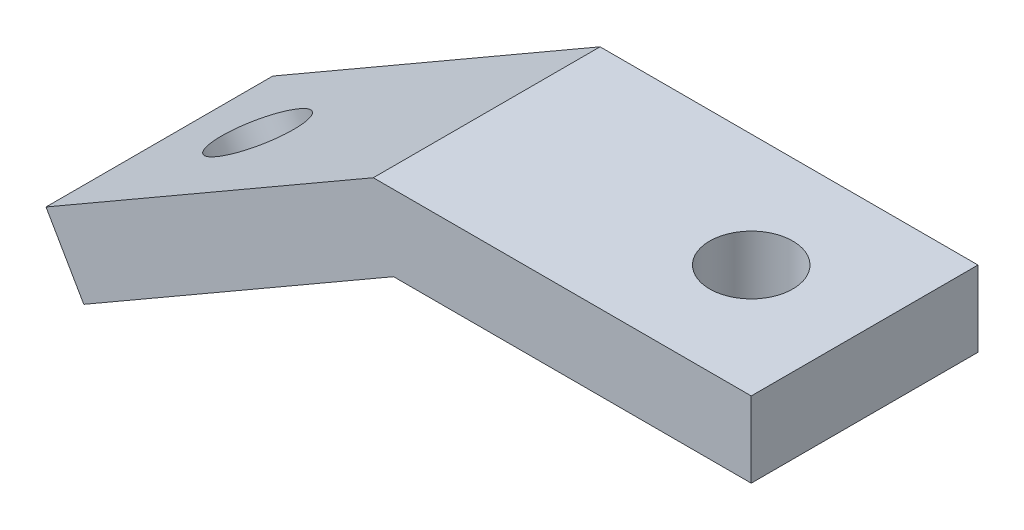
from build123d import *

# Parameters (mm, degrees)
BOSS_EXTRUDE1_DEPTH = 6
SKETCH2_R           = 1.1
CUT_EXTRUDE1_DEPTH  = 6
SKETCH3_R           = 1.1
CUT_EXTRUDE2_DEPTH  = 6


with BuildPart() as part:
    # Sketch1 → Boss-Extrude1 (new body)
    with BuildSketch(Plane.XY):
        Polygon((-8.474611219, -0.340815919), (0.185642819, 4.659184081), (10.185642819, 4.659184081), (10.185642819, 2.659184081), (0.721541204, 2.659184081), (-7.474611219, -2.072866727), align=None)
    extrude(amount=BOSS_EXTRUDE1_DEPTH)

    # Sketch2 → Cut-Extrude1 (cut)
    with BuildSketch(Plane(origin=(0, 4.659184081, 0), x_dir=(1, 0, 0), z_dir=(0, 1, 0))):
        with Locations(Location((7.185642819, -3, 0), (0, 0, 180))):
            Circle(SKETCH2_R)
    extrude(amount=-CUT_EXTRUDE1_DEPTH, mode=Mode.SUBTRACT)

    # Sketch3 → Cut-Extrude2 (cut)
    with BuildSketch(Plane(origin=(-1.971075183, 3.414002362, 0), x_dir=(0.866025403784438, 0.5000000000000012, 0), z_dir=(-0.5000000000000012, 0.866025403784438, 0))):
        with Locations(Location((-4.509636562, -3, 0), (0, 0, 180))):
            Circle(SKETCH3_R)
    extrude(amount=-CUT_EXTRUDE2_DEPTH, mode=Mode.SUBTRACT)


solid = part.part
